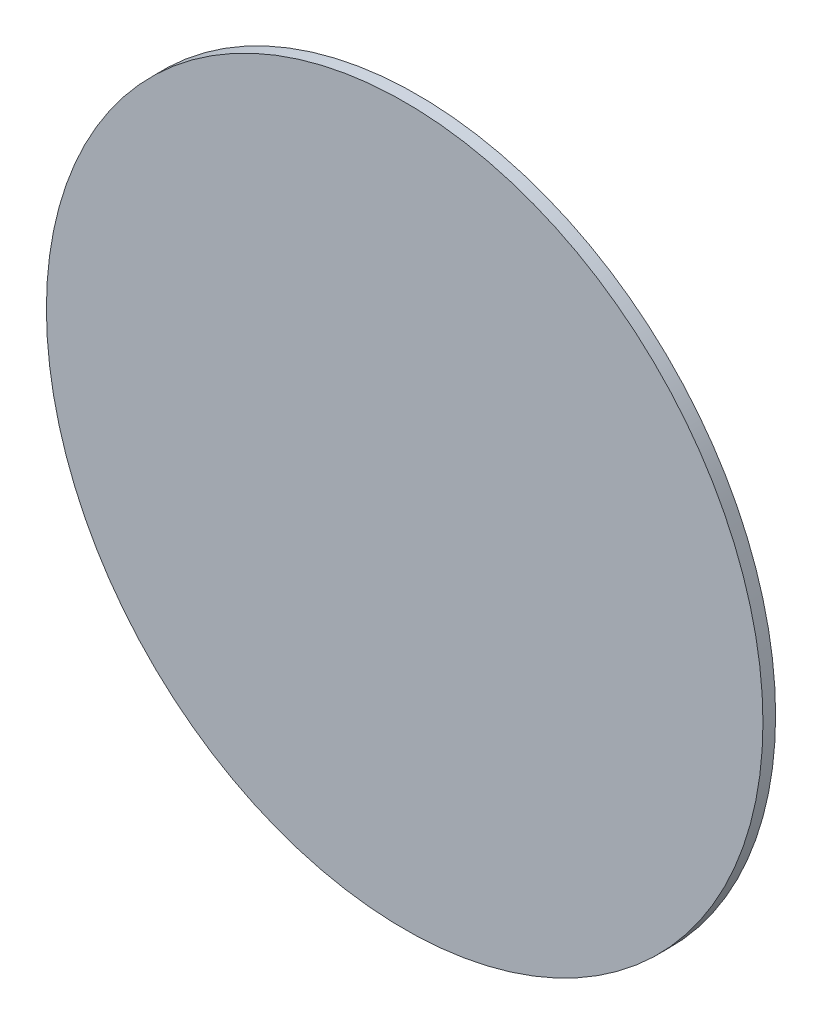
from build123d import *

# Parameters (mm, degrees)
SKETCH1_R           = 42.5
BOSS_EXTRUDE1_DEPTH = 1.5


with BuildPart() as part:
    # Sketch1 → Boss-Extrude1 (new body)
    with BuildSketch(Plane(origin=(0, 0, 0), x_dir=(0, 1, 0), z_dir=(0, 0, 1))):
        with Locations(Location((0, 0, 0), (0, 0, 270))):
            Circle(SKETCH1_R)
    extrude(amount=BOSS_EXTRUDE1_DEPTH)


solid = part.part
